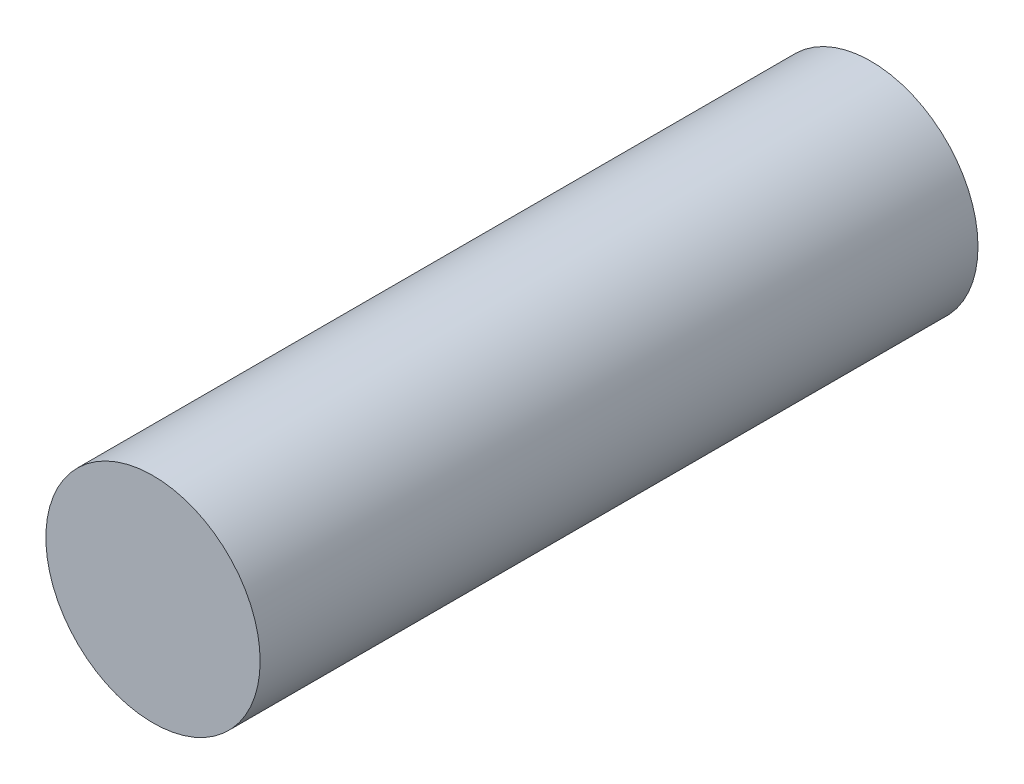
from build123d import *

# Parameters (mm, degrees)
ESQUISSE1_R        = 10
BOSS_EXTRU_1_DEPTH = 67


with BuildPart() as part:
    # Esquisse1 → Boss.-Extru.1 (new body)
    with BuildSketch(Plane.XY):
        Circle(ESQUISSE1_R)
    extrude(amount=BOSS_EXTRU_1_DEPTH)


solid = part.part
